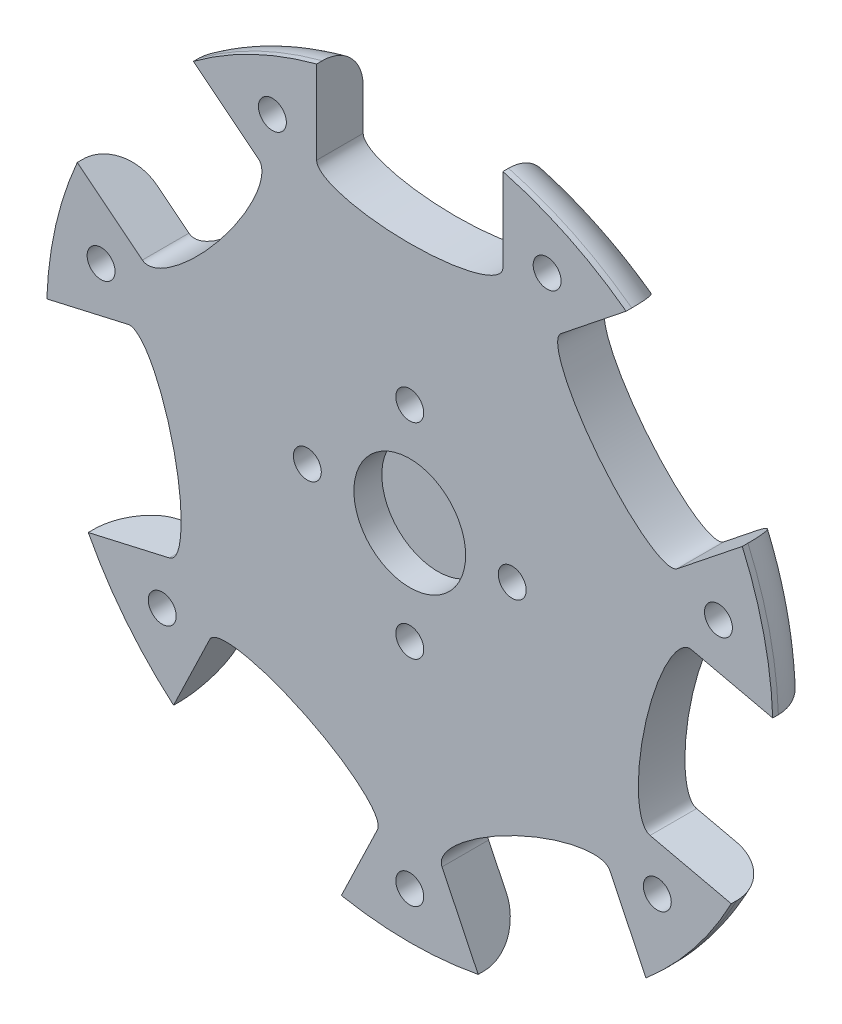
from build123d import *

# Parameters (mm, degrees)
EXTRUDE_2_DEPTH     = 5
SKETCH_3_R          = 1.5
SKETCH_3_R_2        = 6
CUT_EXTRUDE_2_DEPTH = 3
SCALE_1_SCALE       = 0.683
FILLET_2_R          = 3


with BuildPart() as part:
    # 草图1 → 凸台-拉伸2 (new body)
    with BuildSketch(Plane.XY):
        with BuildLine():
            Line((-10, 28.75), (-10, 37.69615365))
            ThreePointArc((-10, 37.69615365), (-16.921465826, 35.137785848), (-23.237141673, 31.321482195))
            Line((-23.237141673, 31.321482195), (-16.242757102, 25.743646628))
            add(Edge.make_bspline(
                [(-28.71255314, 10.107016979), (-26.562516563, 8.392420024), (-20.327618544, 16.210734848), (-14.092720526, 24.029049673), (-16.242757102, 25.743646628)],
                knots=[3.141592654, 3.141592654, 3.141592654, 4.71238898, 4.71238898, 6.283185307, 6.283185307, 6.283185307], degree=2, weights=[1, 0.707106781, 1, 0.707106781, 1]))
            Line((-28.71255314, 10.107016979), (-35.70693771, 15.684852545))
            ThreePointArc((-35.70693771, 15.684852545), (-38.022188575, 8.678316424), (-38.976241715, 1.361095805))
            Line((-38.976241715, 1.361095805), (-30.254386815, 3.351802271))
            add(Edge.make_bspline(
                [(-25.803968136, -16.146755973), (-23.122916377, -15.534823405), (-25.348125717, -5.785544283), (-27.573335056, 3.963734839), (-30.254386815, 3.351802271)],
                knots=[3.141592654, 3.141592654, 3.141592654, 4.71238898, 4.71238898, 6.283185307, 6.283185307, 6.283185307], degree=2, weights=[1, 0.707106781, 1, 0.707106781, 1]))
            Line((-25.803968136, -16.146755973), (-34.525823036, -18.137462439))
            ThreePointArc((-34.525823036, -18.137462439), (-30.491427816, -24.316102272), (-25.365436775, -29.624223487))
            Line((-25.365436775, -29.624223487), (-21.483846179, -21.564017561))
            add(Edge.make_bspline(
                [(-3.464468821, -30.241692343), (-2.271288538, -27.764027957), (-11.280977217, -23.425190565), (-20.290665896, -19.086353174), (-21.483846179, -21.564017561)],
                knots=[3.141592654, 3.141592654, 3.141592654, 4.71238898, 4.71238898, 6.283185307, 6.283185307, 6.283185307], degree=2, weights=[1, 0.707106781, 1, 0.707106781, 1]))
            Line((-3.464468821, -30.241692343), (-7.346059417, -38.301898269))
            ThreePointArc((-7.346059417, -38.301898269), (0, -39), (7.346059417, -38.301898269))
            Line((7.346059417, -38.301898269), (3.464468821, -30.241692343))
            add(Edge.make_bspline(
                [(21.483846179, -21.564017561), (20.290665896, -19.086353174), (11.280977217, -23.425190565), (2.271288538, -27.764027957), (3.464468821, -30.241692343)],
                knots=[3.141592654, 3.141592654, 3.141592654, 4.71238898, 4.71238898, 6.283185307, 6.283185307, 6.283185307], degree=2, weights=[1, 0.707106781, 1, 0.707106781, 1]))
            Line((21.483846179, -21.564017561), (25.365436775, -29.624223487))
            ThreePointArc((25.365436775, -29.624223487), (30.491427816, -24.316102272), (34.525823036, -18.137462439))
            Line((34.525823036, -18.137462439), (25.803968136, -16.146755973))
            add(Edge.make_bspline(
                [(30.254386815, 3.351802271), (27.573335056, 3.963734839), (25.348125717, -5.785544283), (23.122916377, -15.534823405), (25.803968136, -16.146755973)],
                knots=[3.141592654, 3.141592654, 3.141592654, 4.71238898, 4.71238898, 6.283185307, 6.283185307, 6.283185307], degree=2, weights=[1, 0.707106781, 1, 0.707106781, 1]))
            Line((30.254386815, 3.351802271), (38.976241715, 1.361095805))
            ThreePointArc((38.976241715, 1.361095805), (38.022188575, 8.678316424), (35.70693771, 15.684852545))
            Line((35.70693771, 15.684852545), (28.71255314, 10.107016979))
            add(Edge.make_bspline(
                [(16.242757102, 25.743646628), (14.092720526, 24.029049673), (20.327618544, 16.210734848), (26.562516563, 8.392420024), (28.71255314, 10.107016979)],
                knots=[3.141592654, 3.141592654, 3.141592654, 4.71238898, 4.71238898, 6.283185307, 6.283185307, 6.283185307], degree=2, weights=[1, 0.707106781, 1, 0.707106781, 1]))
            Line((16.242757102, 25.743646628), (23.237141673, 31.321482195))
            ThreePointArc((23.237141673, 31.321482195), (16.921465826, 35.137785848), (10, 37.69615365))
            Line((10, 37.69615365), (10, 28.75))
            add(Edge.make_bspline(
                [(-10, 28.75), (-10, 26), (0, 26), (10, 26), (10, 28.75)],
                knots=[3.141592654, 3.141592654, 3.141592654, 4.71238898, 4.71238898, 6.283185307, 6.283185307, 6.283185307], degree=2, weights=[1, 0.707106781, 1, 0.707106781, 1]))
        make_face()
    extrude(amount=EXTRUDE_2_DEPTH)

    # 草图3 → 切除-拉伸2 (cut)
    with BuildSketch(Plane.XY.offset(5)):
        with Locations((0, 11)):
            Circle(SKETCH_3_R)
        with Locations((11, 0)):
            Circle(SKETCH_3_R)
        with Locations((0, -11)):
            Circle(SKETCH_3_R)
        with Locations((-11, 0)):
            Circle(SKETCH_3_R)
        Circle(SKETCH_3_R_2)
        with Locations((14.75204713, 30.632941509)):
            Circle(SKETCH_3_R)
        with Locations((33.147549014, 7.565711755)):
            Circle(SKETCH_3_R)
        with Locations((26.582270404, -21.198653263)):
            Circle(SKETCH_3_R)
        with Locations((0, -34)):
            Circle(SKETCH_3_R)
        with Locations((-26.582270404, -21.198653263)):
            Circle(SKETCH_3_R)
        with Locations((-33.147549014, 7.565711755)):
            Circle(SKETCH_3_R)
        with Locations((-14.75204713, 30.632941509)):
            Circle(SKETCH_3_R)
    extrude(amount=-CUT_EXTRUDE_2_DEPTH, mode=Mode.SUBTRACT)


with BuildPart() as part_1:
    # 缩放比例1: scaled about (3.5878e-05, 0, 2.461657496)
    add(part.part.scale(SCALE_1_SCALE).moved(Location((1.1373e-05, 0, 0.780345426))))

    # 圆角2
    fillet_2_edges = [part_1.edges().sort_by_distance(p)[0] for p in [
        (11.557372532, 23.999107734, 0.780345426),
        (25.96916617, 5.927290118, 0.780345426),
        (20.825656572, -16.607897852, 0.780345426),
        (1.1373e-05, -26.637, 0.780345426),
        (-20.825633825, -16.607897852, 0.780345426),
        (-25.969143423, 5.927290118, 0.780345426),
        (-11.557349786, 23.999107734, 0.780345426),
    ]]
    fillet(fillet_2_edges, radius=FILLET_2_R)


solid = part_1.part
